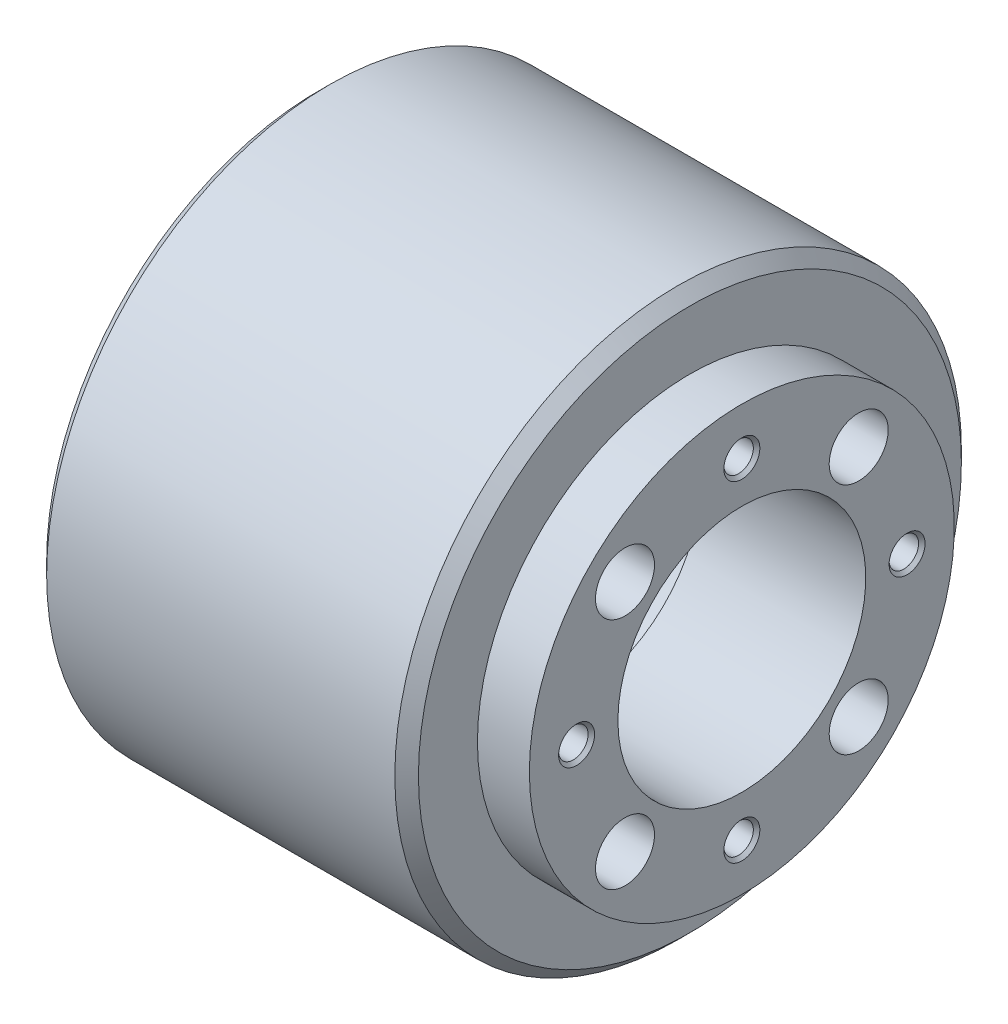
from build123d import *

# Parameters (mm, degrees)
CHAMFER1_SIZE               = 1
M3_TAPPED_HOLE1_D           = 2.5
M3_TAPPED_HOLE1_DEPTH       = 11
M3_TAPPED_HOLE1_CSINK_D     = 3.05
M3_TAPPED_HOLE1_CSINK_ANGLE = 90
M3_TAPPED_HOLE1_TIP         = 0.751075774
SKETCH6_R                   = 2.5
CUT_EXTRUDE1_DEPTH          = 10


with BuildPart() as part:
    # Sketch1 → Revolve1 (revolve)
    with BuildSketch(Plane(origin=(0, 0, 0), x_dir=(1, 0, 0), z_dir=(0, 1, 0)), mode=Mode.PRIVATE) as revolve1_sk:
        Polygon((0, 24), (31.5, 24), (31.5, 18), (35.9, 18), (35.9, 15), (35.9, 10.5), (21.9, 10.5), (21.9, 15), (5.4, 15), (5.4, 19.5), (0, 19.5), align=None)
    revolve(revolve1_sk.sketch.rotate(Axis((0, 0, 0), (1, 0, 0)), 180), axis=Axis((0, 0, 0), (1, 0, 0)))

    # Chamfer1
    chamfer1_edges = [part.edges().sort_by_distance(p)[0] for p in [
        (31.5, 0, -24),
        (0, 0, -24),
        (0, 0, -19.5),
        (5.4, 0, -19.5),
        (5.4, 0, -15),
    ]]
    chamfer(chamfer1_edges, length=CHAMFER1_SIZE)

    # M3 Tapped Hole1
    with Locations(Plane(origin=(35.9, 0, 0), x_dir=(0, 0, -1), z_dir=(1, 0, 0))):
        with Locations((0, 14), (14, 0), (0, -14), (-14, 0)):
            CounterSinkHole(M3_TAPPED_HOLE1_D / 2, M3_TAPPED_HOLE1_CSINK_D / 2, depth=M3_TAPPED_HOLE1_DEPTH, counter_sink_angle=M3_TAPPED_HOLE1_CSINK_ANGLE)
            with Locations((0, 0, -(M3_TAPPED_HOLE1_DEPTH + M3_TAPPED_HOLE1_TIP / 2))):  # 118° drill point
                Cone(0, M3_TAPPED_HOLE1_D / 2, M3_TAPPED_HOLE1_TIP, mode=Mode.SUBTRACT)

    # Sketch6 → Cut-Extrude1 (cut)
    with BuildSketch(Plane(origin=(35.9, 0, 0), x_dir=(0, 0, -1), z_dir=(1, 0, 0))):
        with Locations((-9.899494937, 9.899494937)):
            Circle(SKETCH6_R)
        with Locations(Location((9.899494937, 9.899494937, 0), (0, 0, 180))):
            Circle(SKETCH6_R)
        with Locations((-9.899494937, -9.899494937)):
            Circle(SKETCH6_R)
        with Locations(Location((9.899494937, -9.899494937, 0), (0, 0, 180))):
            Circle(SKETCH6_R)
    extrude(amount=-CUT_EXTRUDE1_DEPTH, mode=Mode.SUBTRACT)


solid = part.part
